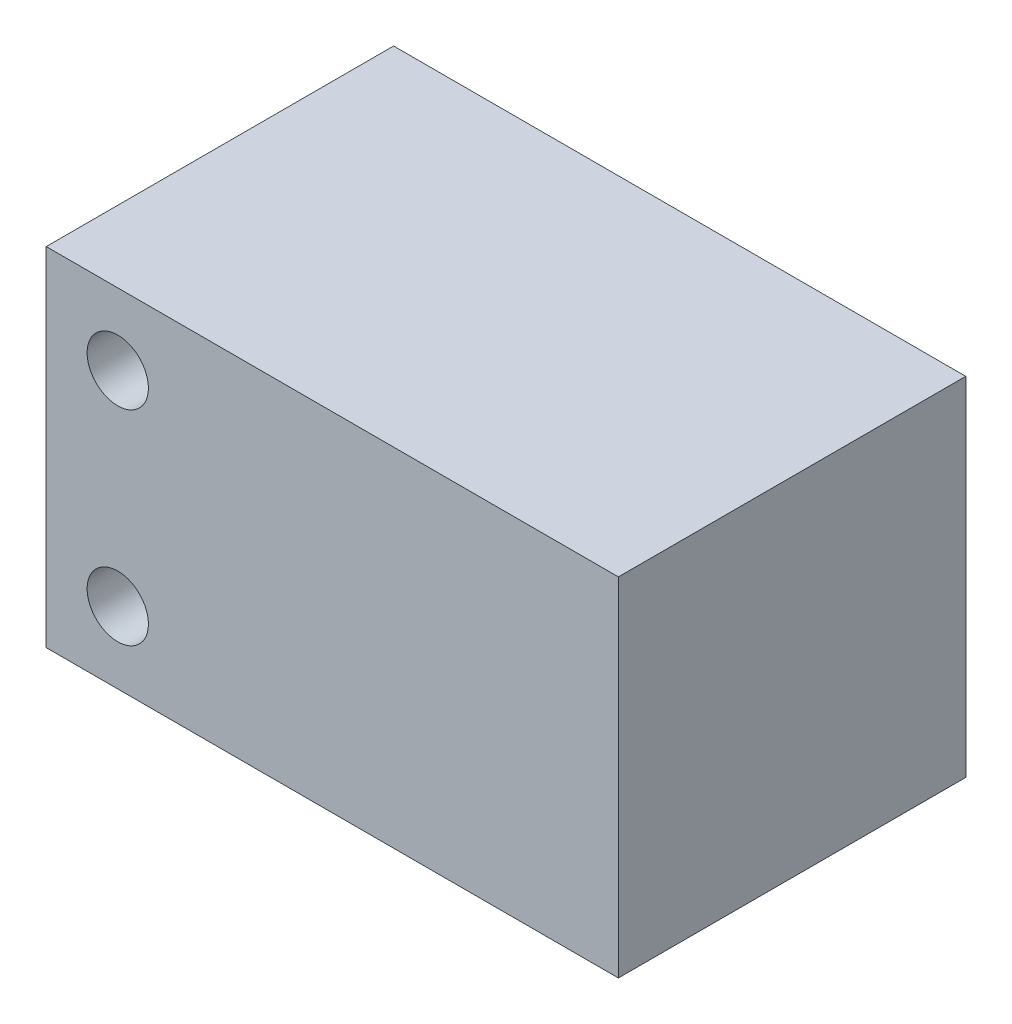
from build123d import *

# Parameters (mm, degrees)
SKETCH_1_W          = 28
SKETCH_1_H          = 17
EXTRUDE_1_DEPTH     = 17
SKETCH_2_R          = 1.5
CUT_EXTRUDE_1_DEPTH = 37.905284174


with BuildPart() as part:
    # 草图1 → 凸台-拉伸1 (new body)
    with BuildSketch(Plane.XY):
        with Locations((14, 8.5)):
            Rectangle(SKETCH_1_W, SKETCH_1_H)
    extrude(amount=EXTRUDE_1_DEPTH)

    # 草图2 → 切除-拉伸1 (cut, through all)
    with BuildSketch(Plane.XY.offset(17)):
        with Locations((3.5, 13.5)):
            Circle(SKETCH_2_R)
        with Locations((3.5, 3.5)):
            Circle(SKETCH_2_R)
    extrude(amount=-CUT_EXTRUDE_1_DEPTH, mode=Mode.SUBTRACT)


solid = part.part
